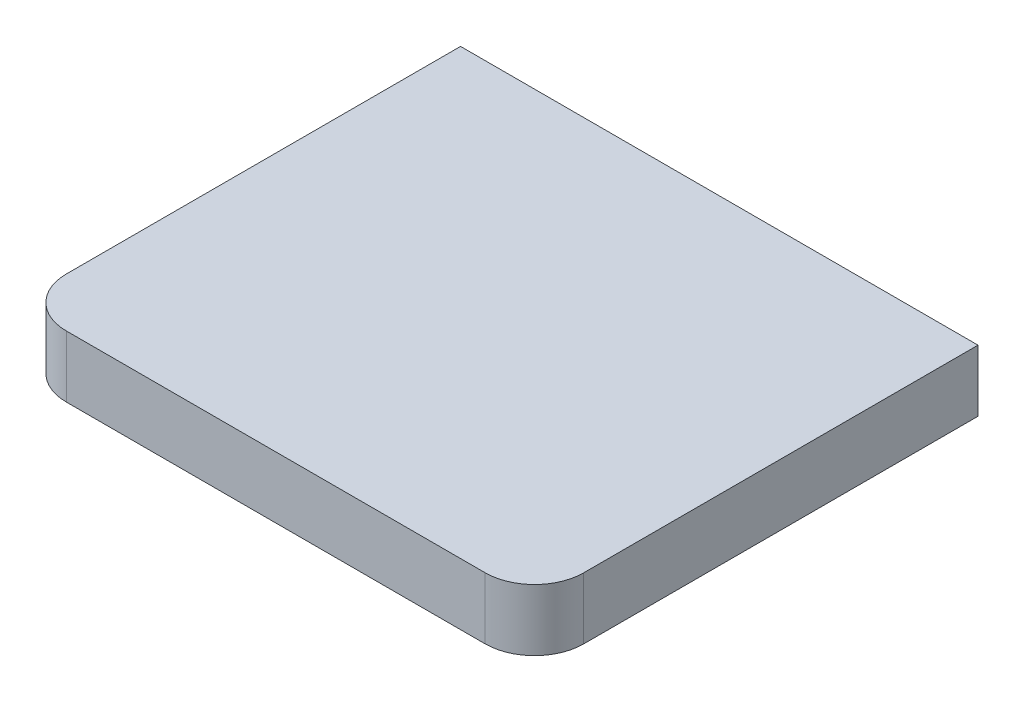
from build123d import *

# Parameters (mm, degrees)
SALIENTE_EXTRUIR1_DEPTH = 50
CROQUIS5_R              = 4
CORTAR_EXTRUIR1_DEPTH   = 25


with BuildPart() as part:
    # Croquis1 → Saliente-Extruir1 (new body)
    with BuildSketch(Plane(origin=(0, 0, 0), x_dir=(1, 0, 0), z_dir=(0, 1, 0))):
        with BuildLine():
            Line((-170, -180), (170, -180))
            ThreePointArc((170, -180), (198.284271247, -168.284271247), (210, -140))
            Line((210, -140), (210, 180))
            Line((210, 180), (-210, 180))
            Line((-210, 180), (-210, -140))
            ThreePointArc((-210, -140), (-198.284271247, -168.284271247), (-170, -180))
        make_face()
    extrude(amount=SALIENTE_EXTRUIR1_DEPTH)

    # Croquis5 → Cortar-Extruir1 (cut)
    with BuildSketch(Plane.XZ):
        with Locations(Location((-170, 90, 0), (0, 0, 270))):
            Circle(CROQUIS5_R)
        with Locations(Location((-170, -90, 0), (0, 0, 90))):
            Circle(CROQUIS5_R)
        with Locations(Location((170, -90, 0), (0, 0, 270))):
            Circle(CROQUIS5_R)
        with Locations(Location((170, 90, 0), (0, 0, 90))):
            Circle(CROQUIS5_R)
    extrude(amount=-CORTAR_EXTRUIR1_DEPTH, mode=Mode.SUBTRACT)


solid = part.part
